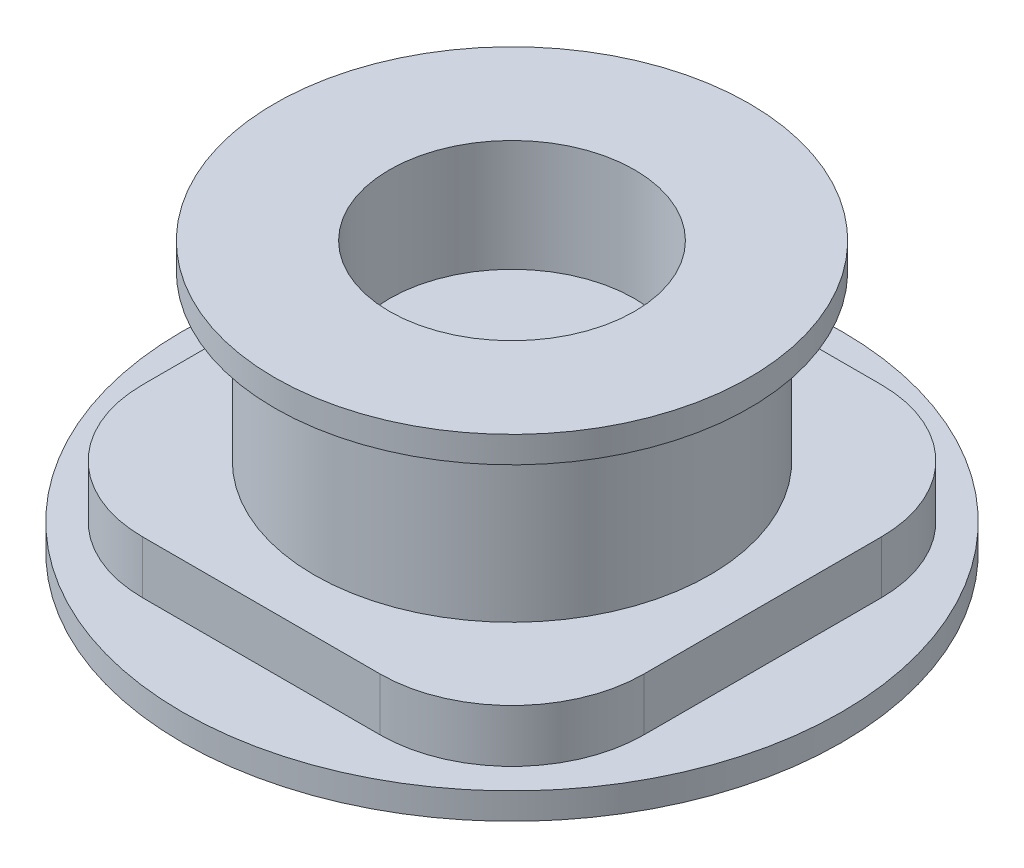
from build123d import *

# Parameters (mm, degrees)
SKETCH_3_W          = 190
SKETCH_3_H          = 190
EXTRUDE_3_DEPTH     = 20
FILLET_2_R          = 50
SKETCH_4_R          = 75
EXTRUDE_4_DEPTH     = 42.3
SKETCH_5_R          = 75
EXTRUDE_5_DEPTH     = 20
SKETCH_14_R         = 90
EXTRUDE_7_DEPTH     = 10
SKETCH_15_R         = 46.5
CUT_EXTRUDE_9_DEPTH = 42.3
SKETCH_12_R         = 54
EXTRUDE_6_DEPTH     = 10
SKETCH_13_R         = 46.5
CUT_EXTRUDE_7_DEPTH = 41.3
SKETCH_18_R         = 125
EXTRUDE_8_DEPTH     = 10


with BuildPart() as part:
    # 草图3 → 凸台-拉伸3 (new body)
    with BuildSketch(Plane(origin=(0, 0, 0), x_dir=(1, 0, 0), z_dir=(0, 1, 0))):
        Rectangle(SKETCH_3_W, SKETCH_3_H)
    extrude(amount=EXTRUDE_3_DEPTH)

    # 圆角2
    fillet_2_edges = [part.edges().sort_by_distance(p)[0] for p in [
        (95, 10, 95),
        (-95, 10, 95),
        (-95, 10, -95),
        (95, 10, -95),
    ]]
    fillet(fillet_2_edges, radius=FILLET_2_R)

    # 草图4 → 凸台-拉伸4 (add)
    with BuildSketch(Plane(origin=(0, 20, 0), x_dir=(1, 0, 0), z_dir=(0, 1, 0))):
        with Locations(Location((0, 0, 0), (0, 0, 270))):
            Circle(SKETCH_4_R)
    extrude(amount=EXTRUDE_4_DEPTH)

    # 草图5 → 凸台-拉伸5 (add)
    with BuildSketch(Plane(origin=(0, 62.3, 0), x_dir=(1, 0, 0), z_dir=(0, 1, 0))):
        with Locations(Location((0, 0, 0), (0, 0, 270))):
            Circle(SKETCH_5_R)
    extrude(amount=EXTRUDE_5_DEPTH)

    # 草图14 → 凸台-拉伸7 (add)
    with BuildSketch(Plane(origin=(0, 82.3, 0), x_dir=(1, 0, 0), z_dir=(0, 1, 0))):
        with Locations(Location((0, 0, 0), (0, 0, 270))):
            Circle(SKETCH_14_R)
    extrude(amount=EXTRUDE_7_DEPTH)

    # 草图15 → 切除-拉伸9 (cut)
    with BuildSketch(Plane(origin=(0, 92.3, 0), x_dir=(1, 0, 0), z_dir=(0, 1, 0))):
        with Locations(Location((0, 0, 0), (0, 0, 270))):
            Circle(SKETCH_15_R)
    extrude(amount=-CUT_EXTRUDE_9_DEPTH, mode=Mode.SUBTRACT)

    # 草图12 → 凸台-拉伸6 (add)
    with BuildSketch(Plane(origin=(0, 82.3, 0), x_dir=(1, 0, 0), z_dir=(0, 1, 0))):
        Circle(SKETCH_12_R)
    extrude(amount=EXTRUDE_6_DEPTH)

    # 草图13 → 切除-拉伸7 (cut)
    with BuildSketch(Plane(origin=(0, 92.3, 0), x_dir=(1, 0, 0), z_dir=(0, 1, 0))):
        with Locations(Location((0, 0, 0), (0, 0, 270))):
            Circle(SKETCH_13_R)
    extrude(amount=-CUT_EXTRUDE_7_DEPTH, mode=Mode.SUBTRACT)

    # 草图18 → 凸台-拉伸8 (add)
    with BuildSketch(Plane.XZ):
        with Locations(Location((0, 0, 0), (0, 0, 270))):
            Circle(SKETCH_18_R)
    extrude(amount=EXTRUDE_8_DEPTH)


solid = part.part
